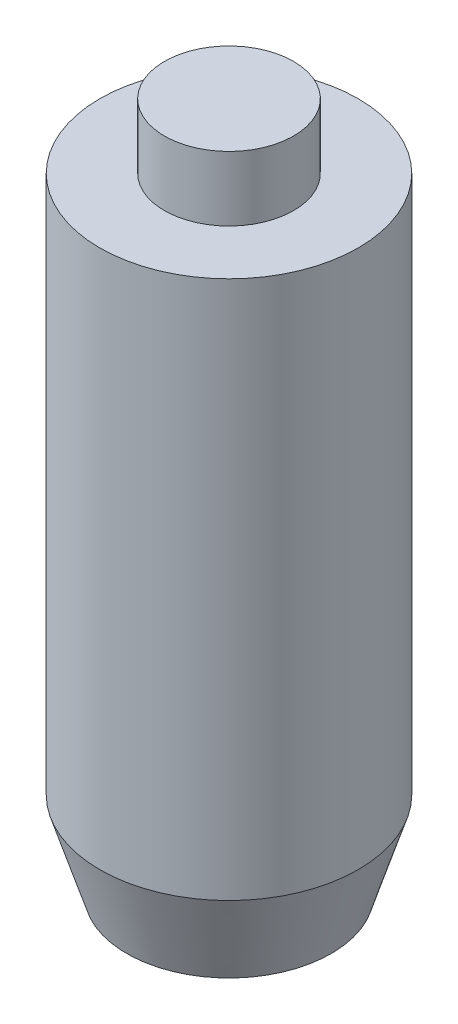
from build123d import *

# Parameters (mm, degrees)
REBAIXO_PARA_SBHCS_M36_D           = 3.4
REBAIXO_PARA_SBHCS_M36_DEPTH       = 5
REBAIXO_PARA_SBHCS_M36_CBORE_D     = 6.7
REBAIXO_PARA_SBHCS_M36_CBORE_DEPTH = 1.65
REBAIXO_PARA_SBHCS_M36_TIP         = 1.021463052


with BuildPart() as part:
    # Esboço1 → Revolução1 (revolve)
    with BuildSketch(Plane.XY, mode=Mode.PRIVATE) as revolu_o1_sk:
        Polygon((29.75, 112.5), (29.75, 105.5), (32, 105.5), (32, 80.5), (34.5, 80.5), (35.75, 84.5), (35.75, 109.5), (32.75, 109.5), (32.75, 112.5), align=None)
    revolve(revolu_o1_sk.sketch.rotate(Axis((29.75, 33.489540419, 0), (0, 1, 0)), 90), axis=Axis((29.75, 33.489540419, 0), (0, 1, 0)))

    # Rebaixo para SBHCS M36
    with Locations(Plane(origin=(0, 0, -6), x_dir=(-1, 0, 0), z_dir=(0, 0, -1))):
        with Locations((-29.75, 99.5)):
            CounterBoreHole(REBAIXO_PARA_SBHCS_M36_D / 2, REBAIXO_PARA_SBHCS_M36_CBORE_D / 2, REBAIXO_PARA_SBHCS_M36_CBORE_DEPTH, depth=REBAIXO_PARA_SBHCS_M36_DEPTH)
            with Locations((0, 0, -(REBAIXO_PARA_SBHCS_M36_DEPTH + REBAIXO_PARA_SBHCS_M36_TIP / 2))):  # 118° drill point
                Cone(0, REBAIXO_PARA_SBHCS_M36_D / 2, REBAIXO_PARA_SBHCS_M36_TIP, mode=Mode.SUBTRACT)


solid = part.part
